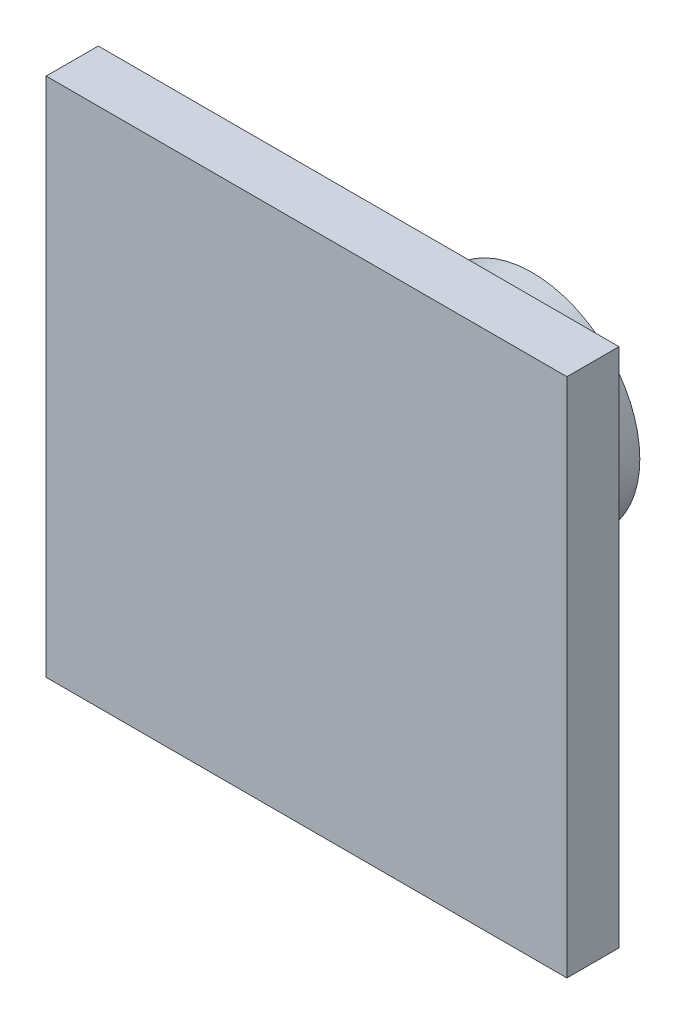
from build123d import *

# Parameters (mm, degrees)
SKETCH_2_W        = 15
SKETCH_2_H        = 15
EXTRUDE_351_DEPTH = 1.5
SKETCH_3_R        = 3.1
SKETCH_3_R_2      = 1.1
EXTRUDE_479_DEPTH = 5
CHAMFER_1_SIZE    = 2


with BuildPart() as part:
    # Эскиз2 → Extrude 351 (new body)
    with BuildSketch(Plane.XY):
        Rectangle(SKETCH_2_W, SKETCH_2_H)
    extrude(amount=EXTRUDE_351_DEPTH)

    # Эскиз3 → Extrude 479 (add)
    with BuildSketch(Plane.XY):
        Circle(SKETCH_3_R)
        Circle(SKETCH_3_R_2, mode=Mode.SUBTRACT)
    extrude(amount=-EXTRUDE_479_DEPTH)

    # Фаска1
    chamfer_1_edges = [part.edges().sort_by_distance(p)[0] for p in [
        (-3.1, 0, 0),
    ]]
    chamfer(chamfer_1_edges, length=CHAMFER_1_SIZE)


solid = part.part
